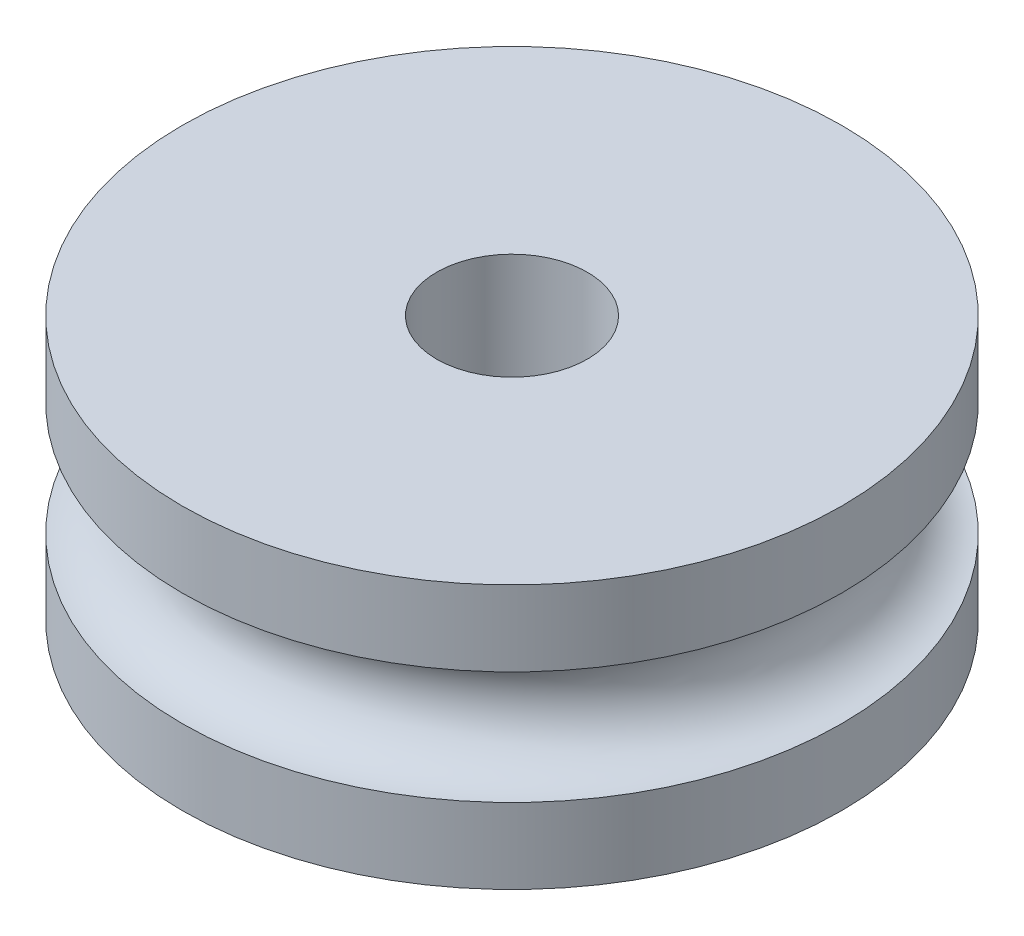
from build123d import *


with BuildPart() as part:
    # Sketch1 → Revolve1 (revolve)
    with BuildSketch(Plane.XY, mode=Mode.PRIVATE) as revolve1_sk:
        with BuildLine():
            Line((-17.5, -7), (-17.5, -3))
            ThreePointArc((-17.5, -3), (-14.5, 0), (-17.5, 3))
            Line((-17.5, 3), (-17.5, 7))
            Line((-17.5, 7), (-4, 7))
            Line((-4, 7), (-4, -7))
            Line((-4, -7), (-17.5, -7))
        make_face()
    revolve(revolve1_sk.sketch.rotate(Axis((0, 7, 0), (0, -1, 0)), 270), axis=Axis((0, 7, 0), (0, -1, 0)))


solid = part.part
